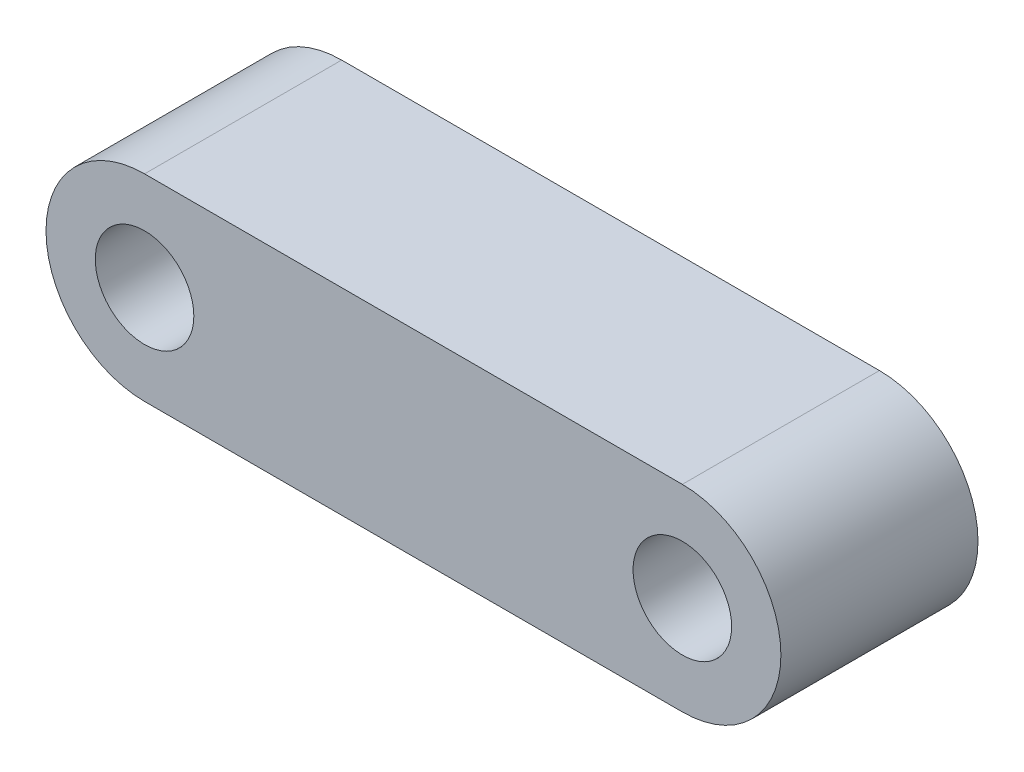
from build123d import *

# Parameters (mm, degrees)
BOSS_EXTRU_1_DEPTH      = 3
BOSS_EXTRU_1_DEPTH_BACK = 3
ESQUISSE1_R             = 1.5


with BuildPart() as part:
    # Esquisse1 → Boss.-Extru.1 (new, two sides: drawn at the far end of the back side and taken through both)
    with BuildSketch(Plane.XY.offset(-BOSS_EXTRU_1_DEPTH_BACK)):
        with BuildLine():
            Line((0, 3), (16.37, 3))
            ThreePointArc((16.37, 3), (19.37, 0), (16.37, -3))
            Line((16.37, -3), (0, -3))
            ThreePointArc((0, -3), (-3, 0), (0, 3))
        make_face()
        Circle(ESQUISSE1_R, mode=Mode.SUBTRACT)
        with Locations((16.37, 0)):
            Circle(ESQUISSE1_R, mode=Mode.SUBTRACT)
    extrude(amount=BOSS_EXTRU_1_DEPTH + BOSS_EXTRU_1_DEPTH_BACK)


solid = part.part
